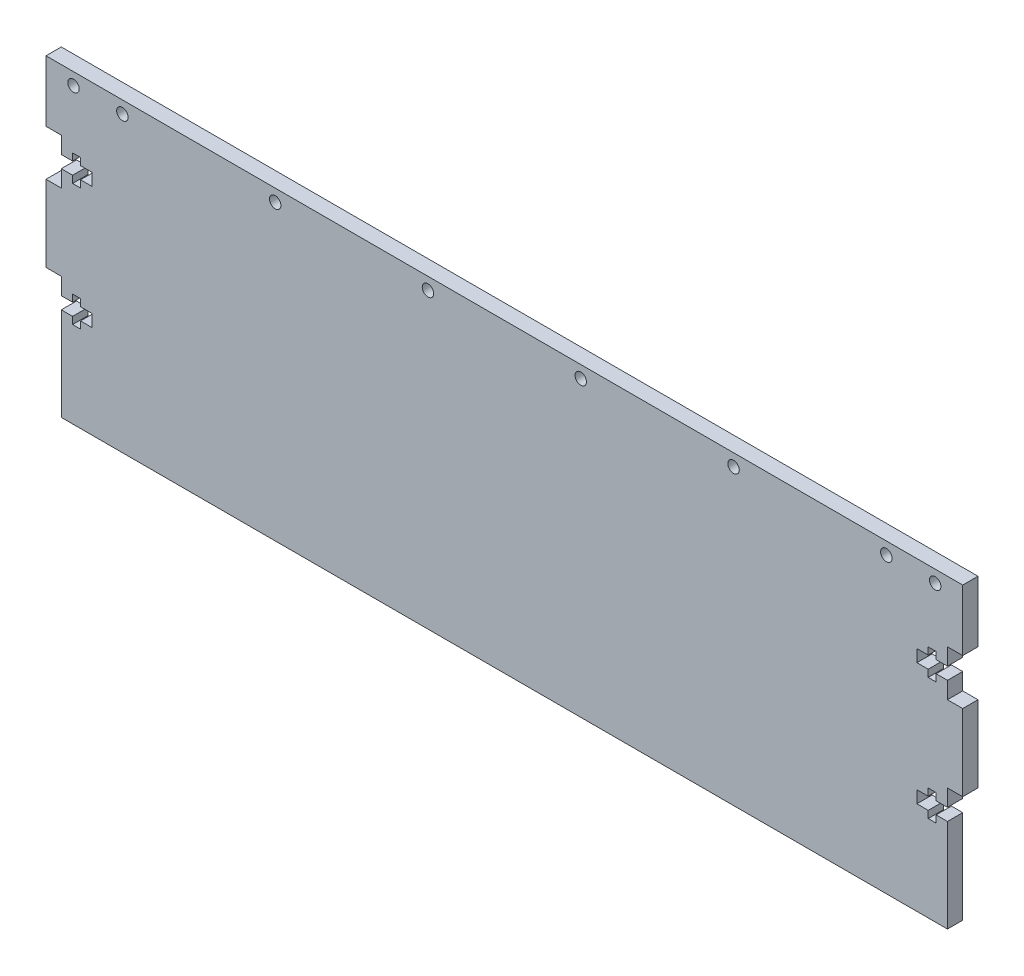
from build123d import *

# Parameters (mm, degrees)
SKETCH2_W            = 381
SKETCH2_H            = 127
BOSS_EXTRUDE1_DEPTH  = 6.35
CUT_EXTRUDE3_DEPTH   = 402.659460862
LPATTERN1_COUNT      = 2
LPATTERN1_PITCH      = 50.8
MIRROR1_COPY_1_DEPTH = 402.659460862
SKETCH6_R            = 2.38125
CUT_EXTRUDE4_DEPTH   = 402.659460862
LPATTERN2_COUNT      = 6
LPATTERN2_PITCH      = 63.5
SKETCH7_R            = 2.38125
CUT_EXTRUDE5_DEPTH   = 402.659460862
SKETCH8_W            = 6.35
SKETCH8_H            = 31.75
CUT_EXTRUDE6_DEPTH   = 402.659460862


with BuildPart() as part:
    # Sketch2 → Boss-Extrude1 (new body)
    with BuildSketch(Plane.XY):
        with Locations((190.5, 63.5)):
            Rectangle(SKETCH2_W, SKETCH2_H)
    extrude(amount=BOSS_EXTRUDE1_DEPTH)

    # Sketch5 → Cut-Extrude3 (cut, through all)
    with BuildSketch(Plane(origin=(0, 0, 0), x_dir=(-1, 0, 0), z_dir=(0, 0, -1))):
        Polygon((-381, 101.6), (-381, 82.55), (-374.65, 82.55), (-374.65, 89.535), (-369.951, 89.535), (-369.951, 86.5759), (-366.649, 86.5759), (-366.649, 89.535), (-361.95, 89.535), (-361.95, 94.615), (-366.649, 94.615), (-366.649, 97.5741), (-369.951, 97.5741), (-369.951, 94.615), (-374.65, 94.615), (-374.65, 101.6), align=None)
    cut_extrude3 = extrude(amount=-CUT_EXTRUDE3_DEPTH, mode=Mode.SUBTRACT)

    # LPattern1: Cut-Extrude3 ×2
    with Locations(*[(0, -i * LPATTERN1_PITCH, 0) for i in range(1, LPATTERN1_COUNT)]):
        add(cut_extrude3, mode=Mode.SUBTRACT)

    # Mirror1: Cut-Extrude3 across plane
    add(cut_extrude3.mirror(Plane.ZY.offset(-190.5)), mode=Mode.SUBTRACT)

    # Mirror1 copy 1 sketch → Mirror1 copy 1 (cut, through all)
    with BuildSketch(Plane(origin=(381, -50.8, 0), x_dir=(1, 0, 0), z_dir=(0, 0, -1))):
        Polygon((-381, -101.6), (-381, -82.55), (-374.65, -82.55), (-374.65, -89.535), (-369.951, -89.535), (-369.951, -86.5759), (-366.649, -86.5759), (-366.649, -89.535), (-361.95, -89.535), (-361.95, -94.615), (-366.649, -94.615), (-366.649, -97.5741), (-369.951, -97.5741), (-369.951, -94.615), (-374.65, -94.615), (-374.65, -101.6), align=None)
    extrude(amount=-MIRROR1_COPY_1_DEPTH, mode=Mode.SUBTRACT)

    # Sketch6 → Cut-Extrude4 (cut, through all)
    with BuildSketch(Plane(origin=(0, 0, 0), x_dir=(-1, 0, 0), z_dir=(0, 0, -1))):
        with Locations((-349.25, 121.92)):
            Circle(SKETCH6_R)
    cut_extrude4 = extrude(amount=-CUT_EXTRUDE4_DEPTH, mode=Mode.SUBTRACT)

    # LPattern2: Cut-Extrude4 ×6
    with Locations(*[(-i * LPATTERN2_PITCH, 0, 0) for i in range(1, LPATTERN2_COUNT)]):
        add(cut_extrude4, mode=Mode.SUBTRACT)

    # Sketch7 → Cut-Extrude5 (cut, through all)
    with BuildSketch(Plane(origin=(0, 0, 0), x_dir=(-1, 0, 0), z_dir=(0, 0, -1))):
        with Locations((-369.57, 121.92)):
            Circle(SKETCH7_R)
    cut_extrude5 = extrude(amount=-CUT_EXTRUDE5_DEPTH, mode=Mode.SUBTRACT)

    # Mirror2: Cut-Extrude5 across plane
    add(cut_extrude5.mirror(Plane.ZY.offset(-190.5)), mode=Mode.SUBTRACT)

    # Sketch8 → Cut-Extrude6 (cut, through all)
    with BuildSketch(Plane(origin=(0, 0, 0), x_dir=(-1, 0, 0), z_dir=(0, 0, -1))):
        with Locations((-377.825, 15.875)):
            Rectangle(SKETCH8_W, SKETCH8_H)
    cut_extrude6 = extrude(amount=-CUT_EXTRUDE6_DEPTH, mode=Mode.SUBTRACT)

    # Mirror3: Cut-Extrude6 across plane
    add(cut_extrude6.mirror(Plane.ZY.offset(-190.5)), mode=Mode.SUBTRACT)


solid = part.part
